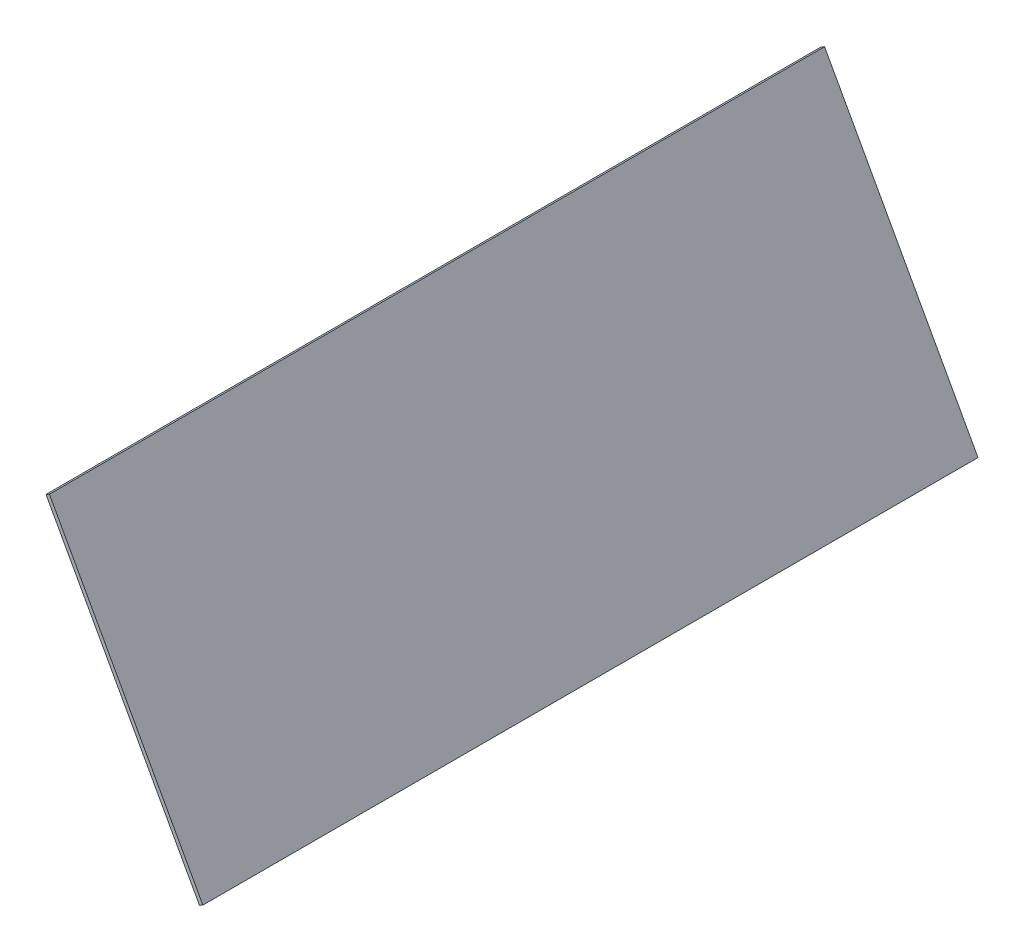
from build123d import *

# Parameters (mm, degrees)
SLOPING_FRONT_CLOSURE_DEPTH = 198


with BuildPart() as part:
    # Sloping front closure profile → Sloping front closure (new body)
    with BuildSketch(Plane.XY):
        Polygon((54, 107), (54.87, 107.48), (94.07, 36.18), (93.2, 35.7), align=None)
    extrude(amount=SLOPING_FRONT_CLOSURE_DEPTH)


solid = part.part
